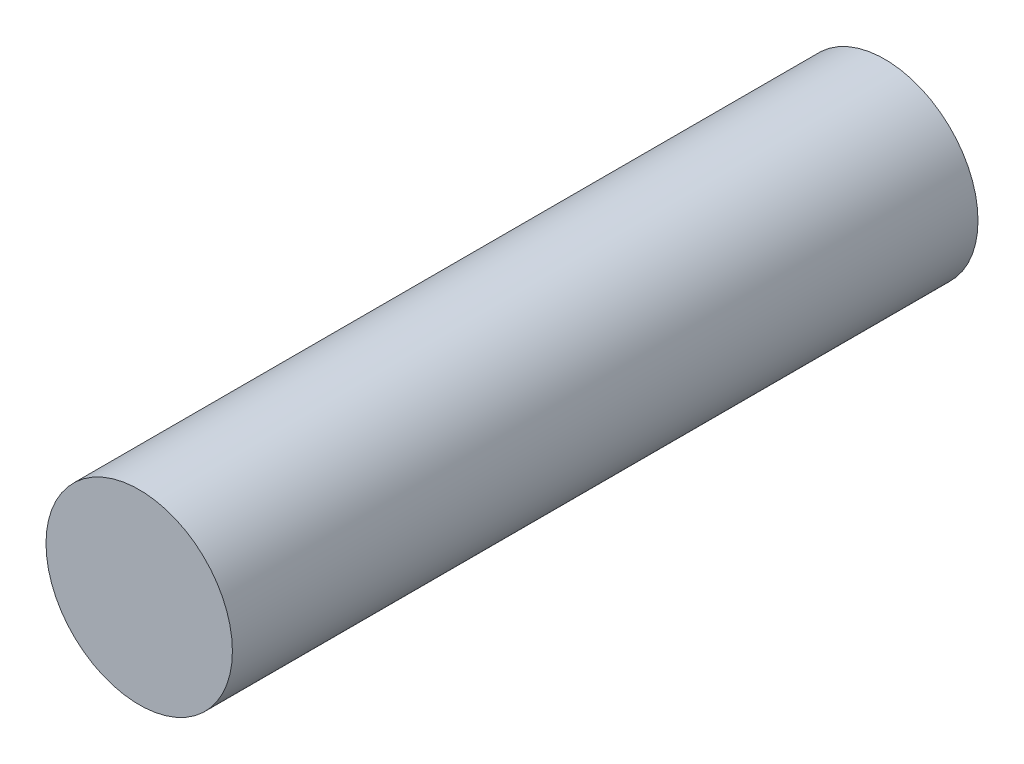
from build123d import *

# Parameters (mm, degrees)
SKETCH1_R           = 1.5
BOSS_EXTRUDE1_DEPTH = 12


with BuildPart() as part:
    # Sketch1 → Boss-Extrude1 (new body)
    with BuildSketch(Plane.XY):
        with Locations((-3.25, -0.25)):
            Circle(SKETCH1_R)
    extrude(amount=BOSS_EXTRUDE1_DEPTH)


solid = part.part
